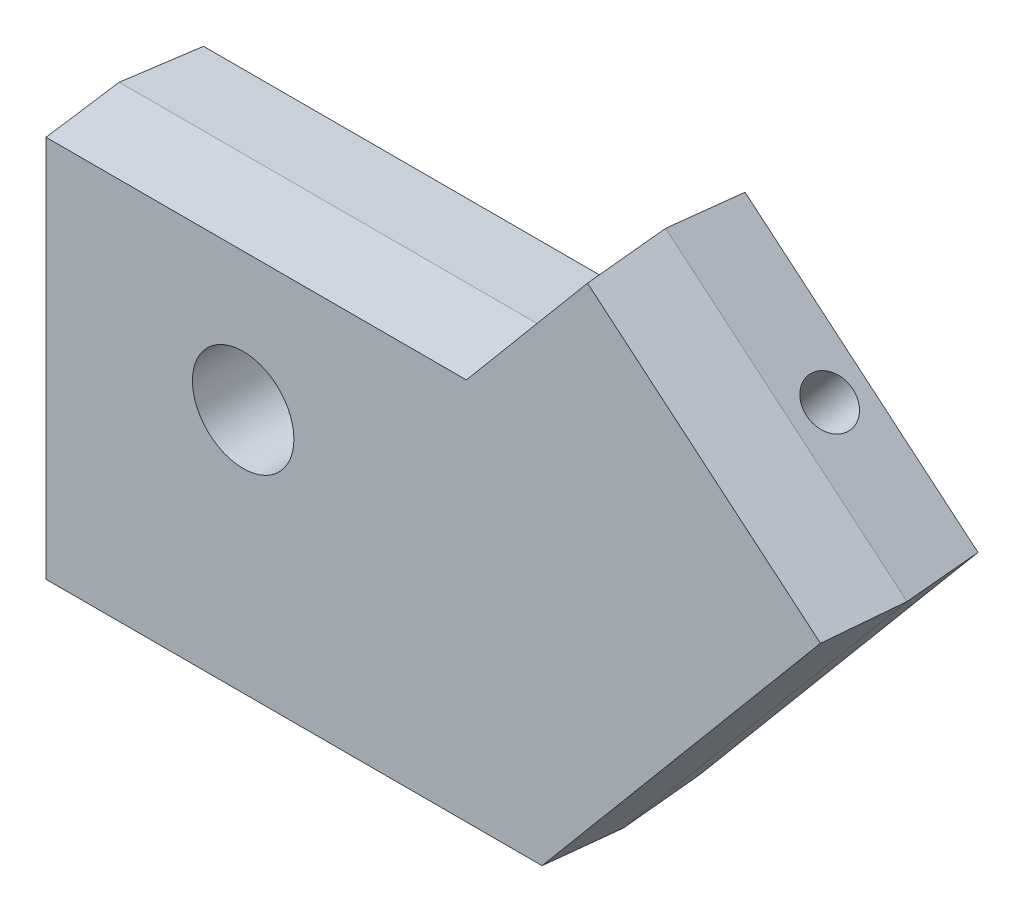
from build123d import *

# Parameters (mm, degrees)
BOSS_EXTRUDE1_DEPTH           = 5
BOSS_EXTRUDE1_DRAFT           = 4
BOSS_EXTRUDE1_OTHER_WAY_DEPTH = 5
BOSS_EXTRUDE1_OTHER_WAY_TAPER = 4
SKETCH7_R                     = 3.219945093
CUT_EXTRUDE1_DEPTH            = 10
SKETCH9_R                     = 1.550098449
CUT_EXTRUDE2_DEPTH            = 12


with BuildPart() as part:
    # Sketch4 → Boss-Extrude1 (with draft: the straight prism first)
    with BuildSketch(Plane.XY):
        Polygon((32, 0), (50, 21.451564667), (34.679111138, 34.30731686), (26.869344993, 25), (0, 25), (0, 0), align=None)
    extrude(amount=BOSS_EXTRUDE1_DEPTH)
    # Boss-Extrude1: the draft: its side faces are tilted about the plane it starts from
    boss_extrude1_sides = [part.faces().sort_by_distance(p)[0] for p in [
        (41, 10.725782333, 2.5),
        (42.339555569, 27.879440764, 2.5),
        (30.774228065, 29.65365843, 2.5),
        (13.434672496, 25, 2.5),
        (0, 12.5, 2.5),
        (16, 0, 2.5),
    ]]
    draft(boss_extrude1_sides, Plane.XY, BOSS_EXTRUDE1_DRAFT)

    # Sketch4 → Boss-Extrude1 other way (add)
    with BuildSketch(Plane.XY):
        Polygon((32, 0), (50, 21.451564667), (34.679111138, 34.30731686), (26.869344993, 25), (0, 25), (0, 0), align=None)
    extrude(amount=-BOSS_EXTRUDE1_OTHER_WAY_DEPTH, taper=BOSS_EXTRUDE1_OTHER_WAY_TAPER)

    # Sketch7 → Cut-Extrude1 (cut)
    with BuildSketch(Plane.XY.offset(5)):
        with Locations((12.864998104, 15.91914525)):
            Circle(SKETCH7_R)
    extrude(amount=-CUT_EXTRUDE1_DEPTH, mode=Mode.SUBTRACT)

    # Sketch9 → Cut-Extrude2 (cut)
    with BuildSketch(Plane(origin=(31.069705783, 37.027433488, -3.379974101), x_dir=(0.7673555816021824, -0.6385668755340675, 0.058290280962054304), z_dir=(0.6412218113757333, 0.7641783973568009, -0.06975647374412532))):
        with Locations(Location((15.007838912, 0, 0), (0, 0, 183.349850625))):
            Circle(SKETCH9_R)
    extrude(amount=-CUT_EXTRUDE2_DEPTH, mode=Mode.SUBTRACT)


solid = part.part
